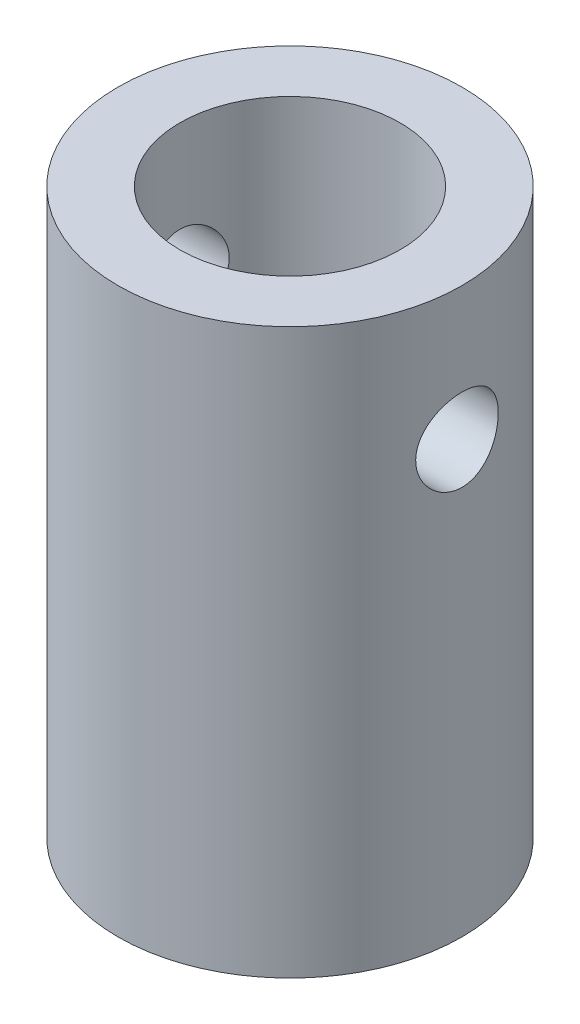
from build123d import *

# Parameters (mm, degrees)
SKETCH_1_R               = 12.5
SKETCH_1_R_2             = 8.001
EXTRUDE_1_DEPTH          = 41
CUT_EXTRUDE_2_DEPTH      = 45.648628198
CUT_EXTRUDE_2_DEPTH_BACK = 45.648628198
SKETCH_4_R               = 3


with BuildPart() as part:
    # 草图1 → 凸台-拉伸1 (new body)
    with BuildSketch(Plane(origin=(0, 0, 0), x_dir=(1, 0, 0), z_dir=(0, 1, 0))):
        with Locations(Location((0, 0, 0), (0, 0, 270))):
            Circle(SKETCH_1_R)
        with Locations(Location((0, 0, 0), (0, 0, 270))):
            Circle(SKETCH_1_R_2, mode=Mode.SUBTRACT)
    extrude(amount=EXTRUDE_1_DEPTH)

    # 草图4 → 切除-拉伸2 (cut, two sides: drawn at the far end of the back side and taken through both)
    with BuildSketch(Plane(origin=(0, 0, 0), x_dir=(0, 0, -1), z_dir=(1, 0, 0)).offset(-CUT_EXTRUDE_2_DEPTH_BACK)):
        with Locations((0, 31.3)):
            Circle(SKETCH_4_R)
    extrude(amount=CUT_EXTRUDE_2_DEPTH + CUT_EXTRUDE_2_DEPTH_BACK, mode=Mode.SUBTRACT)


solid = part.part
